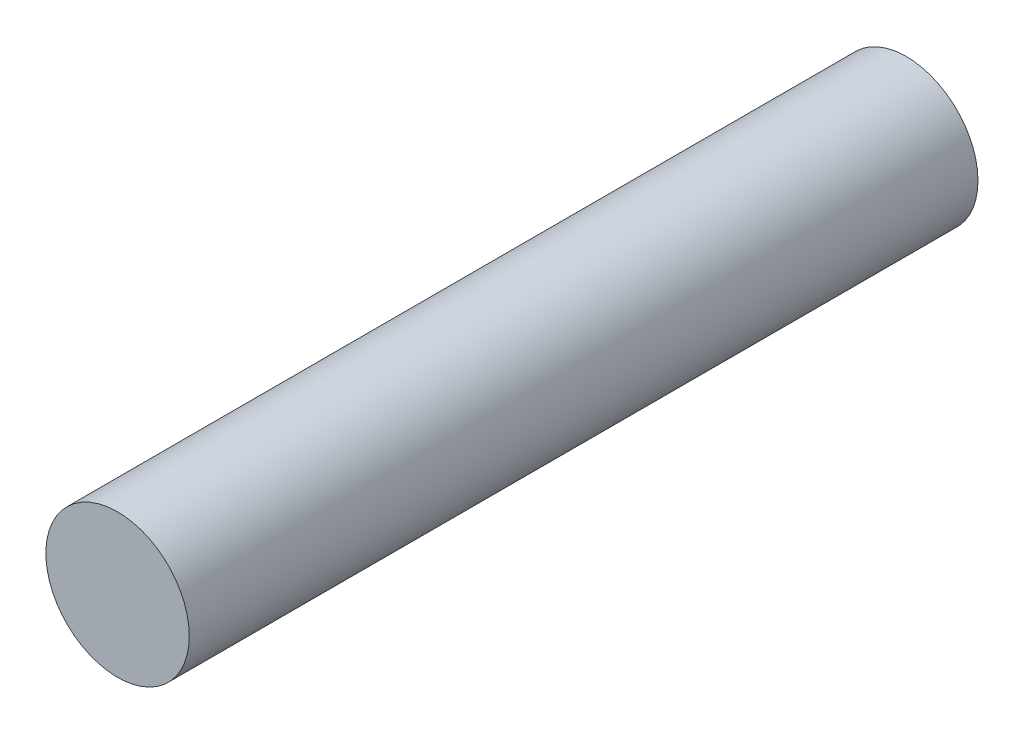
from build123d import *

# Parameters (mm, degrees)
SKETCH1_R           = 10
BOSS_EXTRUDE1_DEPTH = 110


with BuildPart() as part:
    # Sketch1 → Boss-Extrude1 (new body)
    with BuildSketch(Plane.XY):
        Circle(SKETCH1_R)
    extrude(amount=BOSS_EXTRUDE1_DEPTH)


solid = part.part
